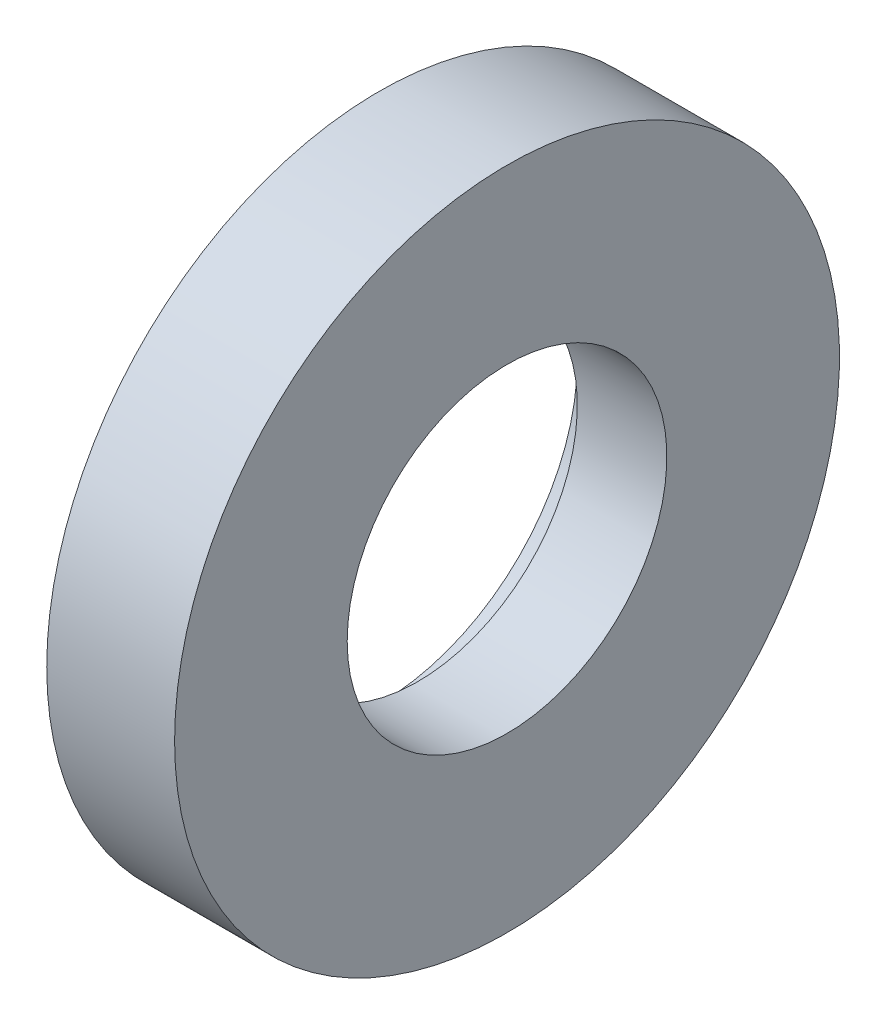
from build123d import *


with BuildPart() as part:
    # Esquisse1 → Révolution1 (revolve)
    with BuildSketch(Plane.XY, mode=Mode.PRIVATE) as r_volution1_sk:
        Polygon((0, 15.5), (0, 26), (10, 26), (10, 12.5), (3, 12.5), (3, 15.5), align=None)
    revolve(r_volution1_sk.sketch.rotate(Axis((-24.149081803, 0, 0), (1, 0, 0)), 90), axis=Axis((-24.149081803, 0, 0), (1, 0, 0)))


solid = part.part
